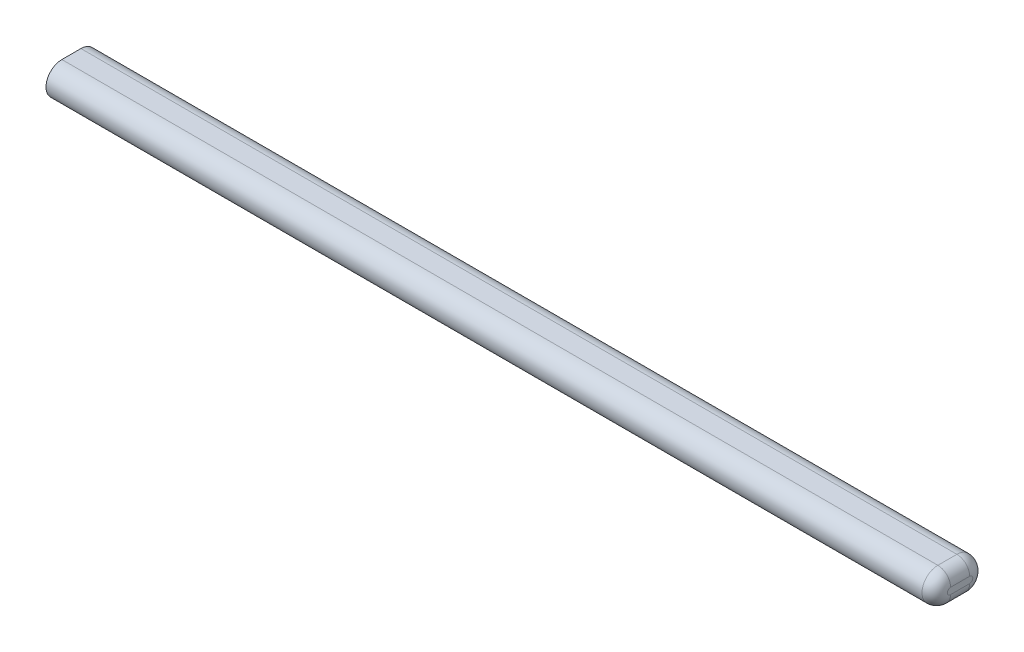
from build123d import *

# Parameters (mm, degrees)
BOSS_EXTRUDE1_DEPTH = 700
FILLET1_R           = 10


with BuildPart() as part:
    # Sketch2 → Boss-Extrude1 (new body)
    with BuildSketch(Plane(origin=(0, 0, 0), x_dir=(0, 0, -1), z_dir=(1, 0, 0))):
        with BuildLine():
            Line((7.5, 12.5), (-7.5, 12.5))
            ThreePointArc((-7.5, 12.5), (-20, 0), (-7.5, -12.5))
            Line((-7.5, -12.5), (7.5, -12.5))
            ThreePointArc((7.5, -12.5), (20, 0), (7.5, 12.5))
        make_face()
    extrude(amount=BOSS_EXTRUDE1_DEPTH)

    # Fillet1
    fillet1_edges = [part.edges().sort_by_distance(p)[0] for p in [
        (700, 0, -20),
        (700, 12.5, 0),
        (700, 0, 20),
        (700, -12.5, 0),
    ]]
    fillet(fillet1_edges, radius=FILLET1_R)


solid = part.part
